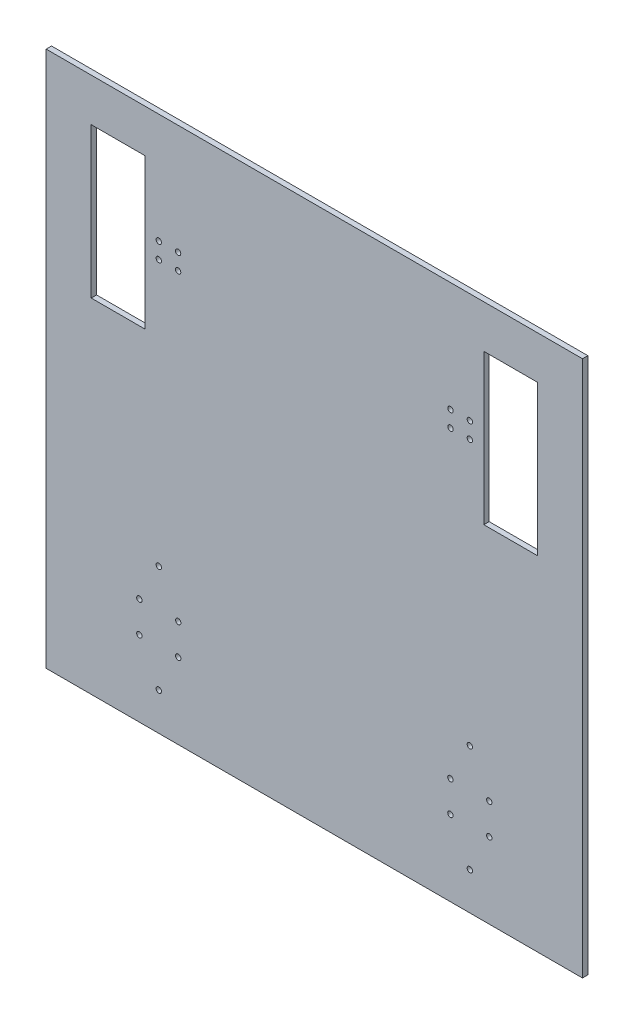
from build123d import *

# Parameters (mm, degrees)
SKETCH1_W           = 500
SKETCH1_H           = 500
SKETCH1_R           = 2.5
SKETCH1_W_2         = 50
SKETCH1_H_2         = 140
BOSS_EXTRUDE1_DEPTH = 5
CUT_EXTRUDE1_START  = -5
SKETCH2_R           = 2.5
CUT_EXTRUDE1_DEPTH  = 5


with BuildPart() as part:
    # Sketch1 → Boss-Extrude1 (new body)
    with BuildSketch(Plane.XY):
        Rectangle(SKETCH1_W, SKETCH1_H)
        with Locations((127, 147.5)):
            Circle(SKETCH1_R, mode=Mode.SUBTRACT)
        with Locations((127, 132.5)):
            Circle(SKETCH1_R, mode=Mode.SUBTRACT)
        with Locations((145, 132.5)):
            Circle(SKETCH1_R, mode=Mode.SUBTRACT)
        with Locations((145, 147.5)):
            Circle(SKETCH1_R, mode=Mode.SUBTRACT)
        with Locations((-145, 147.5)):
            Circle(SKETCH1_R, mode=Mode.SUBTRACT)
        with Locations((-145, 132.5)):
            Circle(SKETCH1_R, mode=Mode.SUBTRACT)
        with Locations((-127, 132.5)):
            Circle(SKETCH1_R, mode=Mode.SUBTRACT)
        with Locations((-127, 147.5)):
            Circle(SKETCH1_R, mode=Mode.SUBTRACT)
        with Locations((183, 140)):
            Rectangle(SKETCH1_W_2, SKETCH1_H_2, mode=Mode.SUBTRACT)
        with Locations((-183, 140)):
            Rectangle(SKETCH1_W_2, SKETCH1_H_2, mode=Mode.SUBTRACT)
    extrude(amount=BOSS_EXTRUDE1_DEPTH)

    # Sketch2 → Cut-Extrude1 (cut)
    with BuildSketch(Plane.XY.offset(5).offset(CUT_EXTRUDE1_START)):
        with Locations((-145, 132.5)):
            Circle(SKETCH2_R)
        with Locations((-163.125, -150.6)):
            Circle(SKETCH2_R)
        with Locations((-126.875, -150.6)):
            Circle(SKETCH2_R)
        with Locations((-126.875, -179.4)):
            Circle(SKETCH2_R)
        with Locations((-163.125, -179.4)):
            Circle(SKETCH2_R)
        with Locations((-145, -115)):
            Circle(SKETCH2_R)
        with Locations((-145, -215)):
            Circle(SKETCH2_R)
        with Locations((145, -215)):
            Circle(SKETCH2_R)
        with Locations((145, -115)):
            Circle(SKETCH2_R)
        with Locations((163.125, -179.4)):
            Circle(SKETCH2_R)
        with Locations((126.875, -179.4)):
            Circle(SKETCH2_R)
        with Locations((126.875, -150.6)):
            Circle(SKETCH2_R)
        with Locations((163.125, -150.6)):
            Circle(SKETCH2_R)
    extrude(amount=CUT_EXTRUDE1_DEPTH, mode=Mode.SUBTRACT)


solid = part.part
